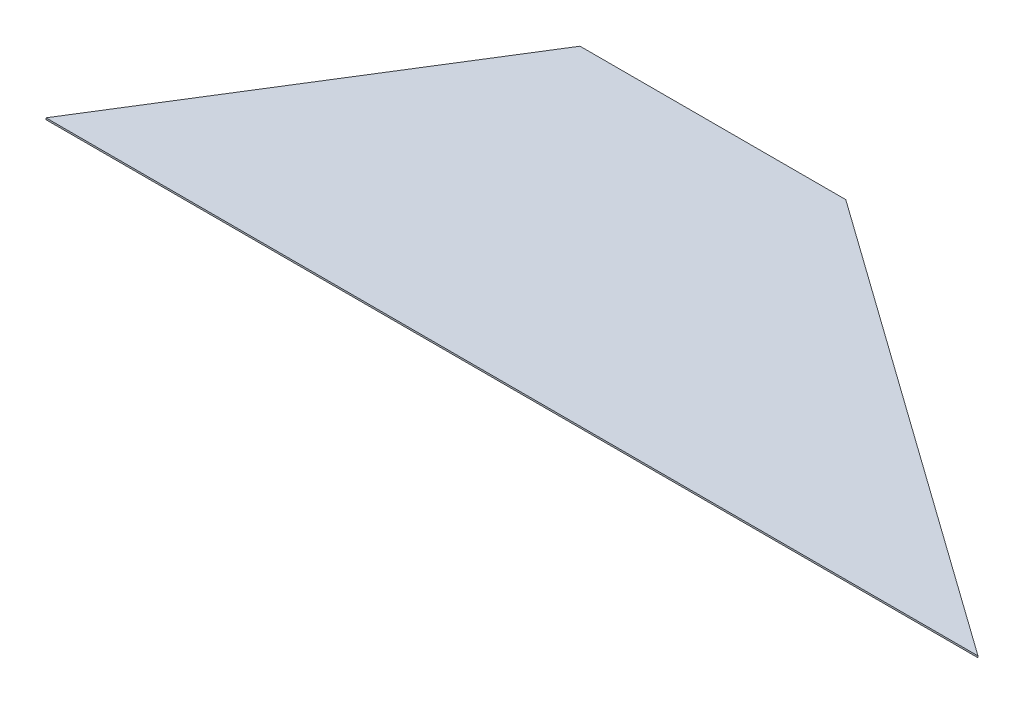
from build123d import *

# Parameters (mm, degrees)
BOSS_EXTRUDE1_DEPTH = 0.762


with BuildPart() as part:
    # Sketch1 → Boss-Extrude1 (new body)
    with BuildSketch(Plane(origin=(0, 0, 0), x_dir=(1, 0, 0), z_dir=(0, 1, 0))):
        Polygon((263.177481941, -51.716628142), (-162.747971892, -51.716628142), (-69.060744478, 98.651371858), (52.381220259, 98.651371858), align=None)
    extrude(amount=BOSS_EXTRUDE1_DEPTH)


solid = part.part
